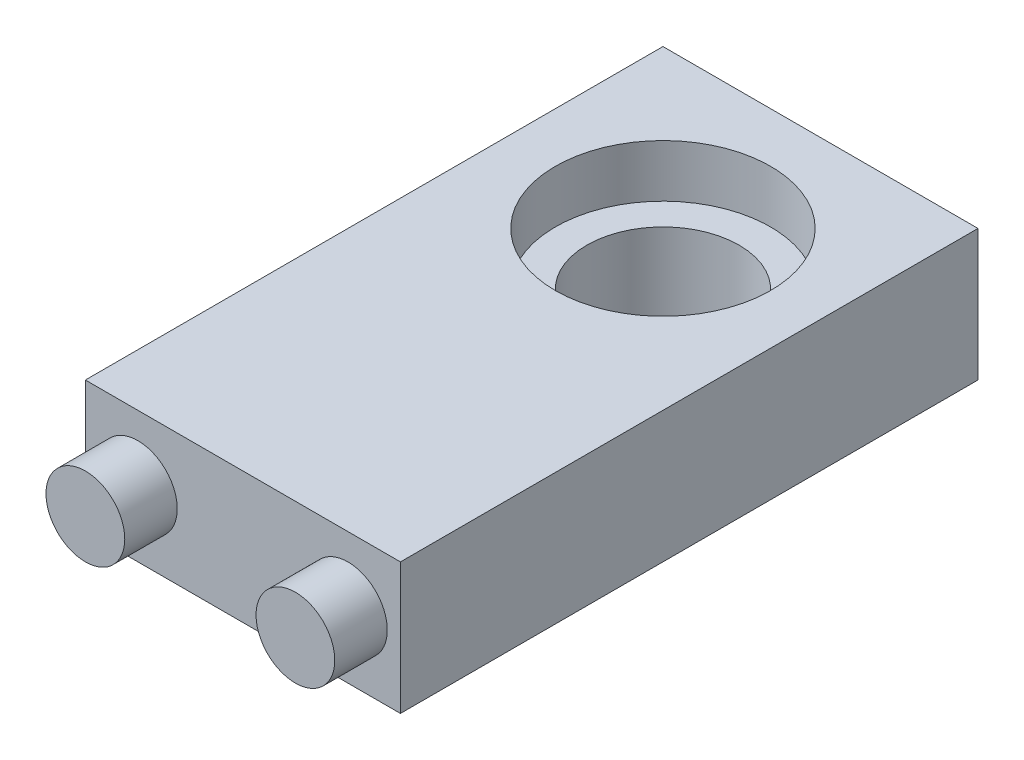
from build123d import *

# Parameters (mm, degrees)
SKETCH_1_W      = 12
SKETCH_1_H      = 22
SKETCH_1_R      = 2.9
EXTRUDE_1_DEPTH = 3
SKETCH_3_W      = 12
SKETCH_3_H      = 22
SKETCH_3_R      = 4.1
EXTRUDE_2_DEPTH = 2
SKETCH_7_R      = 1.5
EXTRUDE_3_DEPTH = 2


with BuildPart() as part:
    # 草图1 → 凸台-拉伸1 (new body)
    with BuildSketch(Plane(origin=(0, 0, 0), x_dir=(1, 0, 0), z_dir=(0, 1, 0))):
        with Locations((6, 11)):
            Rectangle(SKETCH_1_W, SKETCH_1_H)
        with Locations(Location((6, 16, 0), (0, 0, 270))):
            Circle(SKETCH_1_R, mode=Mode.SUBTRACT)
    extrude(amount=EXTRUDE_1_DEPTH)

    # 草图3 → 凸台-拉伸2 (add)
    with BuildSketch(Plane(origin=(0, 3, 0), x_dir=(1, 0, 0), z_dir=(0, 1, 0))):
        with Locations((6, 11)):
            Rectangle(SKETCH_3_W, SKETCH_3_H)
        with Locations(Location((6, 16, 0), (0, 0, 270))):
            Circle(SKETCH_3_R, mode=Mode.SUBTRACT)
    extrude(amount=EXTRUDE_2_DEPTH)

    # 草图7 → 凸台-拉伸3 (add)
    with BuildSketch(Plane.XY):
        with Locations(Location((2, 2.5, 0), (0, 0, 180))):
            Circle(SKETCH_7_R)
        with Locations(Location((10, 2.5, 0), (0, 0, 180))):
            Circle(SKETCH_7_R)
    extrude(amount=EXTRUDE_3_DEPTH)


solid = part.part
